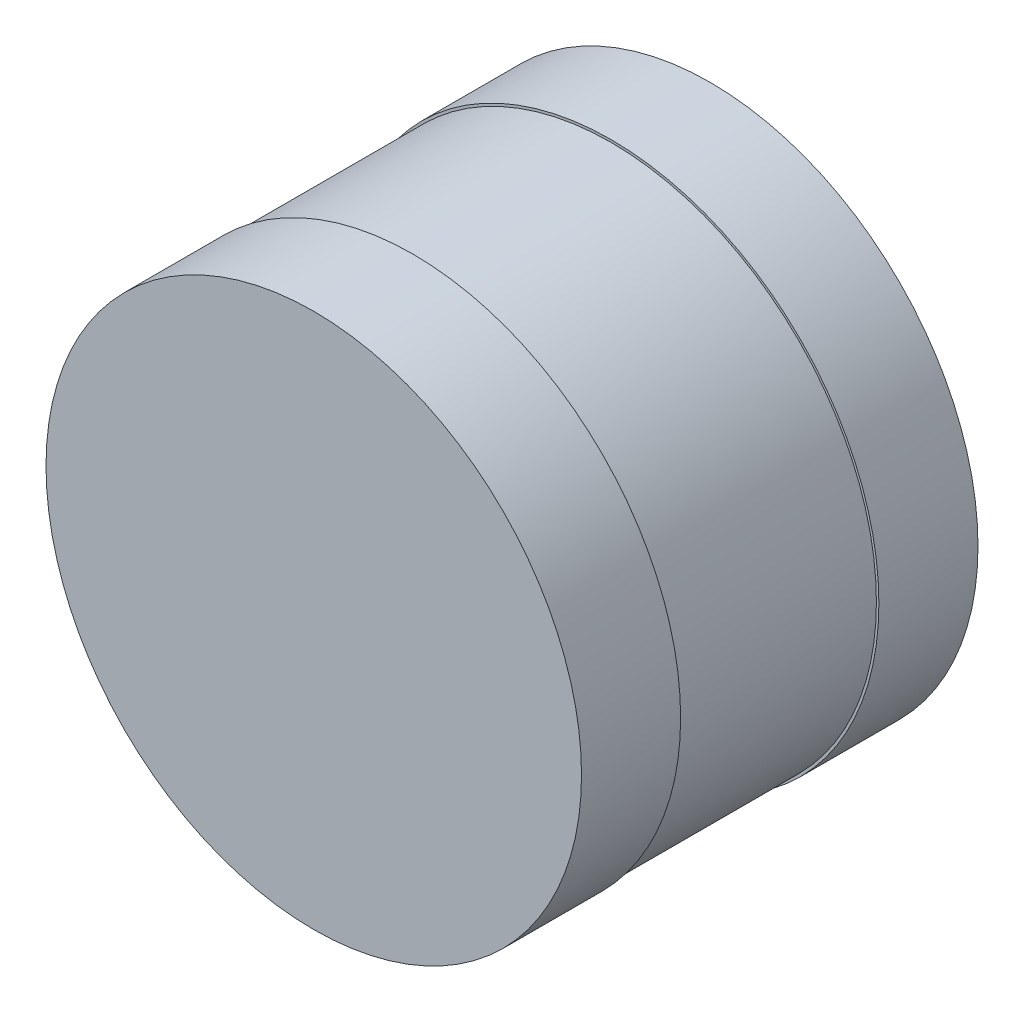
from build123d import *

# Parameters (mm, degrees)
SKETCH1_R           = 54.5
BOSS_EXTRUDE3_DEPTH = 20.175
SKETCH4_R           = 54
BOSS_EXTRUDE5_DEPTH = 40.35
BOSS_EXTRUDE6_START = 20.175
SKETCH5_R           = 54.5
BOSS_EXTRUDE6_DEPTH = 20.175


with BuildPart() as part:
    # Sketch1 → Boss-Extrude3 (new body)
    with BuildSketch(Plane.XY):
        Circle(SKETCH1_R)
    extrude(amount=BOSS_EXTRUDE3_DEPTH)

    # Sketch4 → Boss-Extrude5 (add)
    with BuildSketch(Plane(origin=(0, 0, 0), x_dir=(-1, 0, 0), z_dir=(0, 0, -1))):
        Circle(SKETCH4_R)
    extrude(amount=BOSS_EXTRUDE5_DEPTH)

    # Sketch5 → Boss-Extrude6 (add)
    with BuildSketch(Plane(origin=(0, 0, -40.35), x_dir=(-1, 0, 0), z_dir=(0, 0, -1)).offset(BOSS_EXTRUDE6_START)):
        with Locations(Location((0, 0, 0), (0, 0, 180))):
            Circle(SKETCH5_R)
    extrude(amount=-BOSS_EXTRUDE6_DEPTH)


solid = part.part
